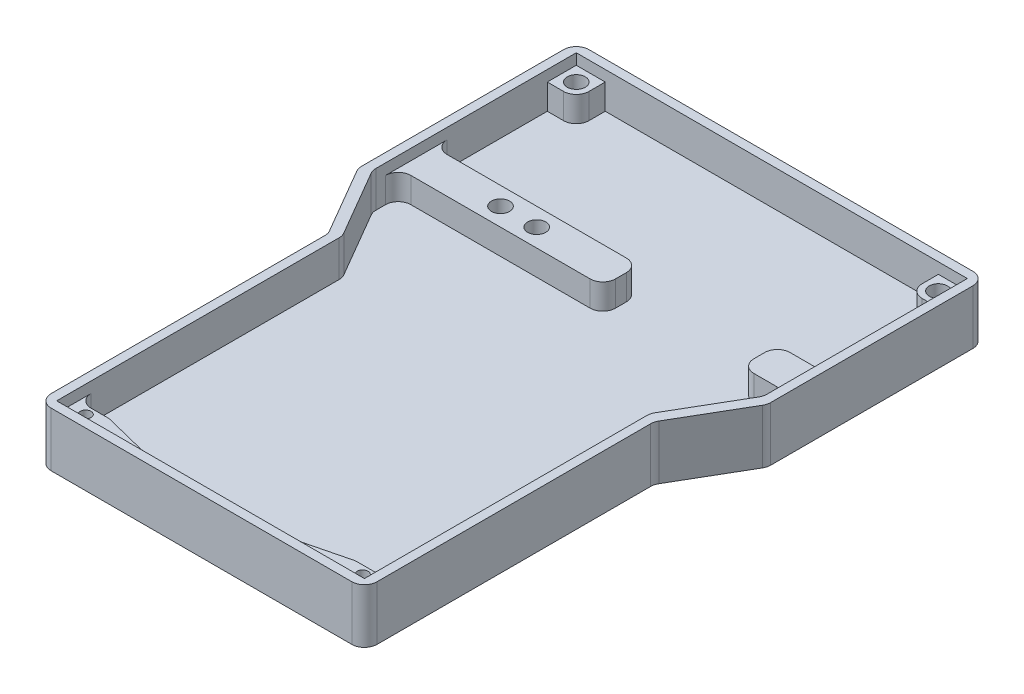
from build123d import *

# Parameters (mm, degrees)
BOSS_EXTRUDE1_DEPTH = 5
BOSS_EXTRUDE2_DEPTH = 10
SKETCH3_R           = 1.5
SKETCH3_W           = 8
SKETCH3_H           = 8
SKETCH3_R_2         = 2.5
BOSS_EXTRUDE3_DEPTH = 7
SKETCH4_W           = 45
SKETCH4_H           = 10
SKETCH4_R           = 2.5
SKETCH4_W_2         = 1.788134659
SKETCH4_W_3         = 11.5
BOSS_EXTRUDE4_DEPTH = 7
FILLET1_R           = 3.5
SKETCH5_R           = 2.5
SKETCH5_R_2         = 2.55926668
SKETCH5_R_3         = 1.5
CUT_EXTRUDE1_DEPTH  = 123.977318254


with BuildPart() as part:
    # Sketch1 → Boss-Extrude1 (new body)
    with BuildSketch(Plane(origin=(0, 0, 0), x_dir=(1, 0, 0), z_dir=(0, 1, 0))):
        Polygon((-57.597316241, 51.805869074), (-57.597316241, -8.444130926), (-46.097316241, -28.194130926), (-46.097316241, -108.194130926), (43.902683759, -108.194130926), (43.902683759, -28.194130926), (55.402683759, -8.444130926), (55.402683759, 51.805869074), align=None)
    extrude(amount=BOSS_EXTRUDE1_DEPTH)

    # Sketch2 → Boss-Extrude2 (add)
    with BuildSketch(Plane(origin=(0, 5, 0), x_dir=(1, 0, 0), z_dir=(0, 1, 0))):
        Polygon((-46.097316241, -28.194130926), (-46.097316241, -108.194130926), (43.902683759, -108.194130926), (43.902683759, -28.194130926), (41.402683759, -28.194130926), (41.402683759, -105.694130926), (-43.597316241, -105.694130926), (-43.597316241, -28.194130926), align=None)
        Polygon((52.902683759, -6.988434723), (55.402683759, -8.444130926), (43.902683759, -28.194130926), (41.402683759, -26.738434723), align=None)
        Polygon((41.402683759, -28.194130926), (43.902683759, -28.194130926), (41.402683759, -26.738434723), align=None)
        Polygon((52.902683759, -6.988434723), (55.402683759, -8.444130926), (55.402683759, -6.988434723), align=None)
        Polygon((-57.597316241, 51.805869074), (-57.597316241, -6.988434723), (-55.097316241, -6.988434723), (-55.097316241, 49.305869074), (52.902683759, 49.305869074), (52.902683759, -6.988434723), (55.402683759, -6.988434723), (55.402683759, 51.805869074), align=None)
        Polygon((-43.597316241, -26.738434723), (-46.097316241, -28.194130926), (-43.597316241, -28.194130926), align=None)
        Polygon((-43.597316241, -26.738434723), (-46.097316241, -28.194130926), (-57.597316241, -8.444130926), (-55.097316241, -6.988434723), align=None)
        Polygon((-57.597316241, -6.988434723), (-57.597316241, -8.444130926), (-55.097316241, -6.988434723), align=None)
    extrude(amount=BOSS_EXTRUDE2_DEPTH)

    # Sketch3 → Boss-Extrude3 (add)
    # profile 1 of 3: a face of its own
    with BuildSketch(Plane(origin=(0, 5, 0), x_dir=(1, 0, 0), z_dir=(0, 1, 0))):
        Polygon((-43.597316241, -99.694130926), (-43.597316241, -105.694130926), (41.402683759, -105.694130926), (41.402683759, -99.694130926), (32.902683759, -99.694130926), (20.902683759, -102.694130926), (-23.097316241, -102.694130926), (-35.097316241, -99.694130926), align=None)
        with Locations(Location((-39.347316241, -101.944130926, 0), (0, 0, 270))):
            Circle(SKETCH3_R, mode=Mode.SUBTRACT)
        with Locations(Location((37.152683759, -101.944130926, 0), (0, 0, 270))):
            Circle(SKETCH3_R, mode=Mode.SUBTRACT)
    # profile 2 of 3: a face of its own
    with BuildSketch(Plane(origin=(0, 5, 0), x_dir=(1, 0, 0), z_dir=(0, 1, 0))):
        with Locations((-51.097316241, 45.305869074)):
            Rectangle(SKETCH3_W, SKETCH3_H)
        with Locations(Location((-51.097316241, 45.305869074, 0), (0, 0, 270))):
            Circle(SKETCH3_R_2, mode=Mode.SUBTRACT)
    # profile 3 of 3: a face of its own
    with BuildSketch(Plane(origin=(0, 5, 0), x_dir=(1, 0, 0), z_dir=(0, 1, 0))):
        with Locations((48.902683759, 45.305869074)):
            Rectangle(SKETCH3_W, SKETCH3_H)
        with Locations(Location((48.902683759, 45.305869074, 0), (0, 0, 270))):
            Circle(SKETCH3_R_2, mode=Mode.SUBTRACT)
    extrude(amount=BOSS_EXTRUDE3_DEPTH)

    # Sketch4 → Boss-Extrude4 (add)
    # profile 1 of 4: a face of its own
    with BuildSketch(Plane(origin=(0, 5, 0), x_dir=(1, 0, 0), z_dir=(0, 1, 0))):
        with Locations((-21.097316241, 5.130869074)):
            Rectangle(SKETCH4_W, SKETCH4_H)
        with Locations(Location((-31.847316241, 5.130869074, 0), (0, 0, 270))):
            Circle(SKETCH4_R, mode=Mode.SUBTRACT)
        with Locations(Location((-21.847316241, 5.130869074, 0), (0, 0, 270))):
            Circle(SKETCH4_R, mode=Mode.SUBTRACT)
    # profile 2 of 4: a face of its own
    with BuildSketch(Plane(origin=(0, 5, 0), x_dir=(1, 0, 0), z_dir=(0, 1, 0))):
        with Locations((40.50861643, 5.130869074)):
            Rectangle(SKETCH4_W_2, SKETCH4_H)
    # profile 3 of 4: a face of its own
    with BuildSketch(Plane(origin=(0, 5, 0), x_dir=(1, 0, 0), z_dir=(0, 1, 0))):
        with Locations((-49.347316241, 5.130869074)):
            Rectangle(SKETCH4_W_3, SKETCH4_H)
    # profile 4 of 4: a face of its own
    with BuildSketch(Plane(origin=(0, 5, 0), x_dir=(1, 0, 0), z_dir=(0, 1, 0))):
        with Locations((47.152683759, 5.130869074)):
            Rectangle(SKETCH4_W_3, SKETCH4_H)
    extrude(amount=BOSS_EXTRUDE4_DEPTH)

    # Fillet1
    fillet1_edges = [part.edges().sort_by_distance(p)[0] for p in [
        (41.402683759, 8.5, 99.694130926),
        (32.902683759, 8.5, 99.694130926),
        (20.902683759, 8.5, 102.694130926),
        (-23.097316241, 8.5, 102.694130926),
        (-35.097316241, 8.5, 99.694130926),
        (-43.597316241, 8.5, 99.694130926),
        (-47.097316241, 8.5, -41.305869074),
        (44.902683759, 8.5, -41.305869074),
        (55.402683759, 7.5, 8.444130926),
        (43.902683759, 7.5, 28.194130926),
        (43.902683759, 7.5, 108.194130926),
        (-46.097316241, 7.5, 108.194130926),
        (-46.097316241, 7.5, 28.194130926),
        (-57.597316241, 7.5, 8.444130926),
        (-57.597316241, 7.5, -51.805869074),
        (55.402683759, 7.5, -51.805869074),
        (52.902683759, 8.5, -10.130869074),
        (39.6145491, 8.5, -10.130869074),
        (39.6145491, 8.5, -0.130869074),
        (52.902683759, 8.5, -0.130869074),
        (1.402683759, 8.5, -10.130869074),
        (1.402683759, 8.5, -0.130869074),
        (-55.097316241, 8.5, -0.130869074),
        (-55.097316241, 8.5, -10.130869074),
        (-43.597316241, 10, 26.738434723),
        (-55.097316241, 10, 6.988434723),
        (52.902683759, 10, 6.988434723),
        (41.402683759, 10, 26.738434723),
    ]]
    fillet(fillet1_edges, radius=FILLET1_R)

    # Sketch5 → Cut-Extrude1 (cut, through all)
    with BuildSketch(Plane(origin=(0, 5, 0), x_dir=(1, 0, 0), z_dir=(0, 1, 0))):
        with Locations(Location((-21.847316241, 5.130869074, 0), (0, 0, 270))):
            Circle(SKETCH5_R)
        with Locations(Location((-31.847316241, 5.130869074, 0), (0, 0, 270))):
            Circle(SKETCH5_R_2)
        with Locations(Location((-39.347316241, -101.944130926, 0), (0, 0, 270))):
            Circle(SKETCH5_R_3)
        with Locations(Location((37.152683759, -101.944130926, 0), (0, 0, 270))):
            Circle(SKETCH5_R_3)
        with Locations(Location((-51.097316241, 45.305869074, 0), (0, 0, 270))):
            Circle(SKETCH5_R)
        with Locations(Location((48.902683759, 45.305869074, 0), (0, 0, 270))):
            Circle(SKETCH5_R)
    extrude(amount=-CUT_EXTRUDE1_DEPTH, mode=Mode.SUBTRACT)


solid = part.part
